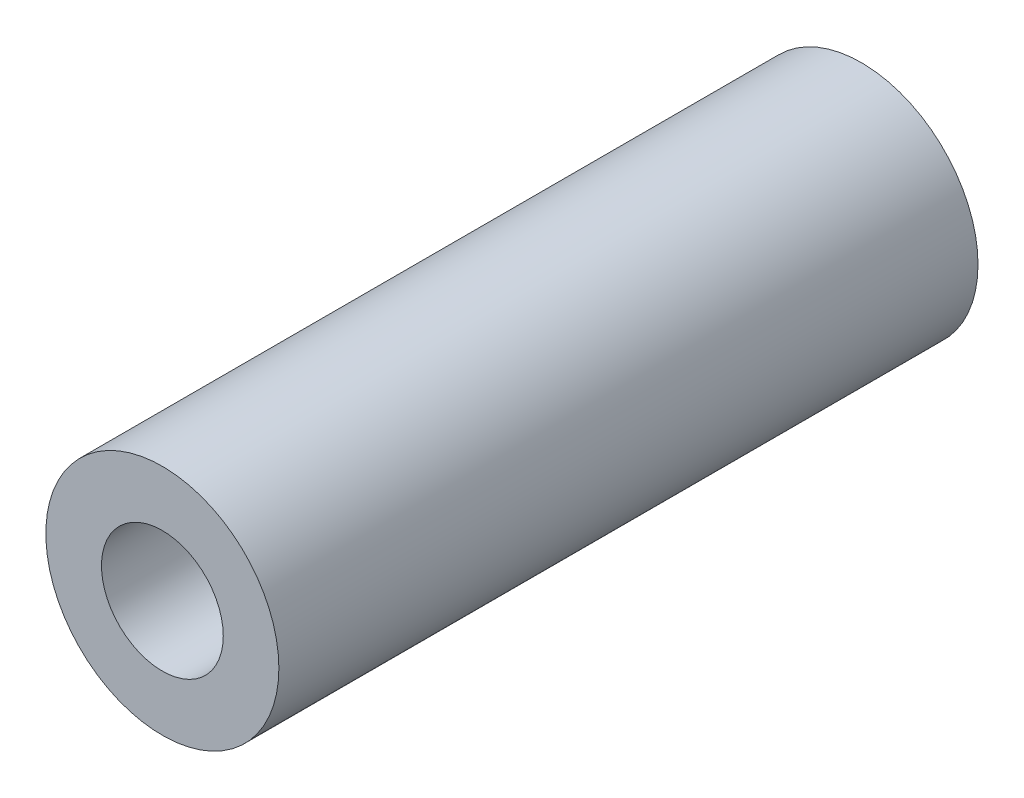
from build123d import *

# Parameters (mm, degrees)
SKETCH1_R           = 4.7625
SKETCH1_R_2         = 2.4892
BOSS_EXTRUDE1_DEPTH = 28.575


with BuildPart() as part:
    # Sketch1 → Boss-Extrude1 (new body)
    with BuildSketch(Plane.XY):
        Circle(SKETCH1_R)
        Circle(SKETCH1_R_2, mode=Mode.SUBTRACT)
    extrude(amount=BOSS_EXTRUDE1_DEPTH)


solid = part.part
